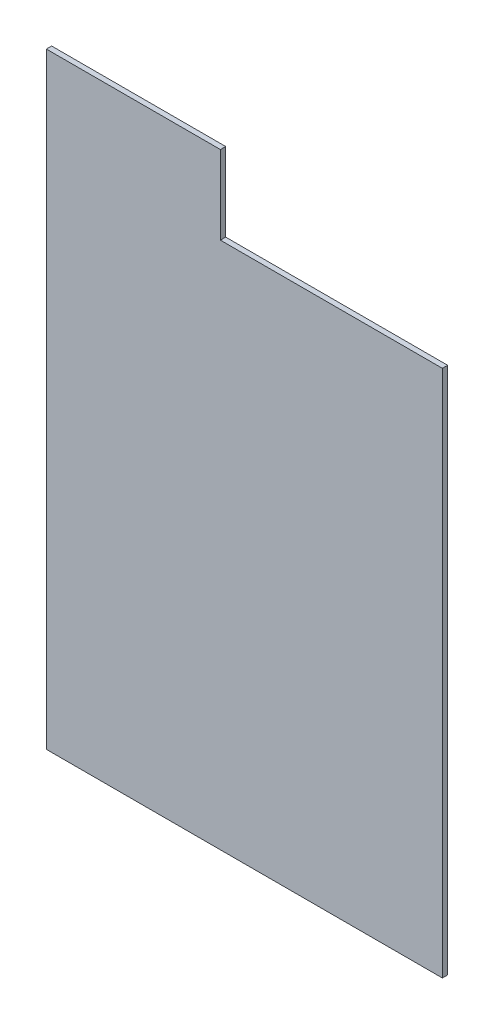
from build123d import *

# Parameters (mm, degrees)
BOSS_EXTRUDE1_DEPTH = 1


with BuildPart() as part:
    # Sketch1 → Boss-Extrude1 (new body)
    with BuildSketch(Plane.XY):
        Polygon((0, 100), (0, 114.863880064), (32.966525573, 114.863880064), (32.966525573, 100), (75, 100), (75, 0), (0, 0), align=None)
    extrude(amount=BOSS_EXTRUDE1_DEPTH)


solid = part.part
